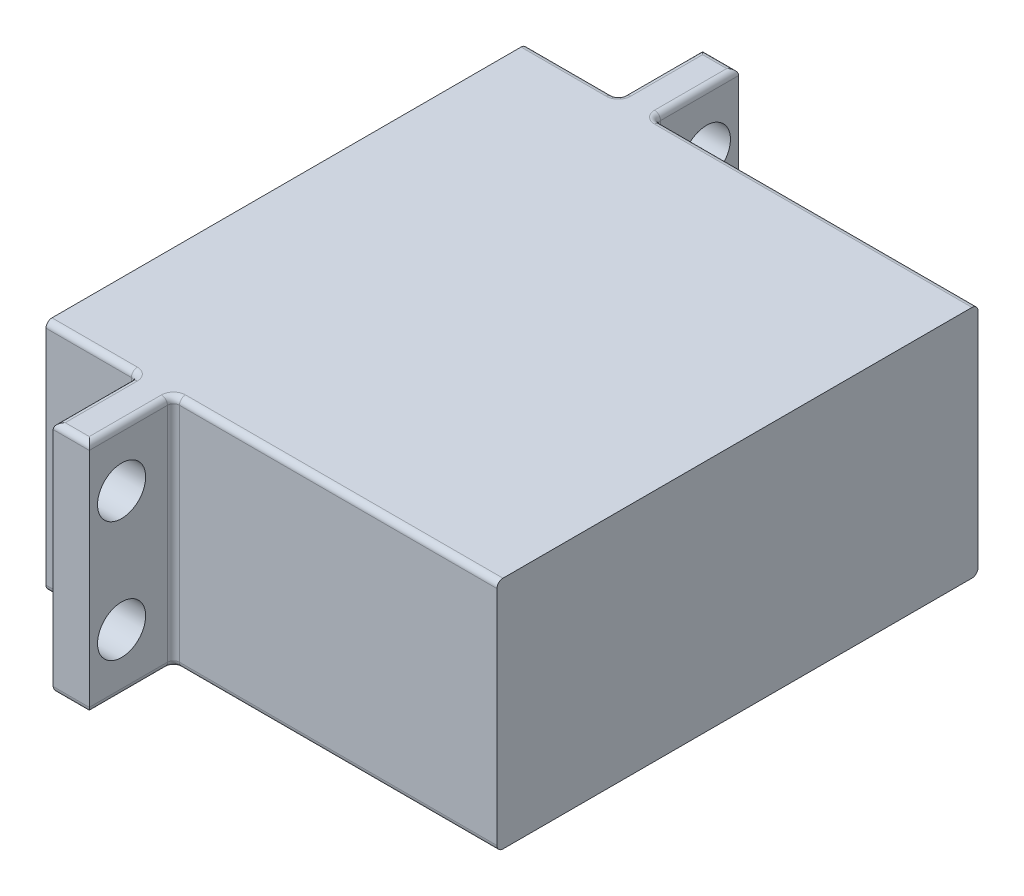
from build123d import *

# Parameters (mm, degrees)
SKETCH_1_W          = 37.5
SKETCH_1_H          = 19.5
EXTRUDE_1_DEPTH     = 40
SKETCH_2_W          = 7
SKETCH_2_H          = 19.5
EXTRUDE_2_DEPTH     = 3
CUT_EXTRUDE_START   = -70.872542033
SKETCH_3_R          = 2
CUT_EXTRUDE_5_DEPTH = 73.872542033
SKETCH_4_R          = 2.45
EXTRUDE_3_DEPTH     = 4
FILLET_1_R          = 0.5


with BuildPart() as part:
    # 草图1 → 凸台-拉伸1 (new body)
    with BuildSketch(Plane.XY):
        with Locations((-27.096153846, 34.403846154)):
            Rectangle(SKETCH_1_W, SKETCH_1_H)
    extrude(amount=EXTRUDE_1_DEPTH)

    # 草图2 → 凸台-拉伸2 (add)
    with BuildSketch(Plane.ZY.offset(35.246153846)):
        with Locations((-3.5, 34.403846154)):
            Rectangle(SKETCH_2_W, SKETCH_2_H)
        with Locations((43.5, 34.403846154)):
            Rectangle(SKETCH_2_W, SKETCH_2_H)
    extrude(amount=EXTRUDE_2_DEPTH)

    # 草图3 → 切除-拉伸5 (cut)
    with BuildSketch(Plane.ZY.offset(35.246153846).offset(CUT_EXTRUDE_START)):
        with Locations((-4.315, 39.403846154)):
            Circle(SKETCH_3_R)
        with Locations((-4.315, 29.403846154)):
            Circle(SKETCH_3_R)
    cut_extrude_5 = extrude(amount=CUT_EXTRUDE_5_DEPTH, mode=Mode.SUBTRACT)

    # 草图4 → 凸台-拉伸3 (add)
    with BuildSketch(Plane.ZY.offset(45.846153846)):
        with Locations((30, 34.403846154)):
            Circle(SKETCH_4_R)
    extrude(amount=EXTRUDE_3_DEPTH)

    # 圆角1
    fillet_1_edges = [part.edges().sort_by_distance(p)[0] for p in [
        (-42.046153846, 44.153846154, 40),
        (-42.046153846, 24.653846154, 40),
        (-42.046153846, 24.653846154, 0),
        (-42.046153846, 44.153846154, 0),
        (-49.846153846, 34.403846154, 27.55),
        (-35.246153846, 34.403846154, 40),
        (-35.246153846, 24.653846154, 43.5),
        (-35.246153846, 44.153846154, 43.5),
        (-38.246153846, 34.403846154, 40),
        (-38.246153846, 24.653846154, 43.5),
        (-38.246153846, 44.153846154, 43.5),
        (-36.746153846, 44.153846154, 47),
        (-35.246153846, 34.403846154, 0),
        (-35.246153846, 44.153846154, -3.5),
        (-35.246153846, 24.653846154, -3.5),
        (-38.246153846, 34.403846154, 0),
        (-38.246153846, 44.153846154, -3.5),
        (-38.246153846, 24.653846154, -3.5),
        (-36.746153846, 24.653846154, -7),
        (-36.746153846, 44.153846154, -7),
        (-36.746153846, 24.653846154, 47),
        (-21.796153846, 24.653846154, 0),
        (-21.796153846, 44.153846154, 40),
        (-21.796153846, 44.153846154, 0),
        (-21.796153846, 24.653846154, 40),
    ]]
    fillet(fillet_1_edges, radius=FILLET_1_R)

    # 镜向1: 切除-拉伸5 across plane
    add(cut_extrude_5.mirror(Plane(origin=(0, 0, 20), x_dir=(1, 0, 0), z_dir=(0, 0, -1))), mode=Mode.SUBTRACT)


solid = part.part
